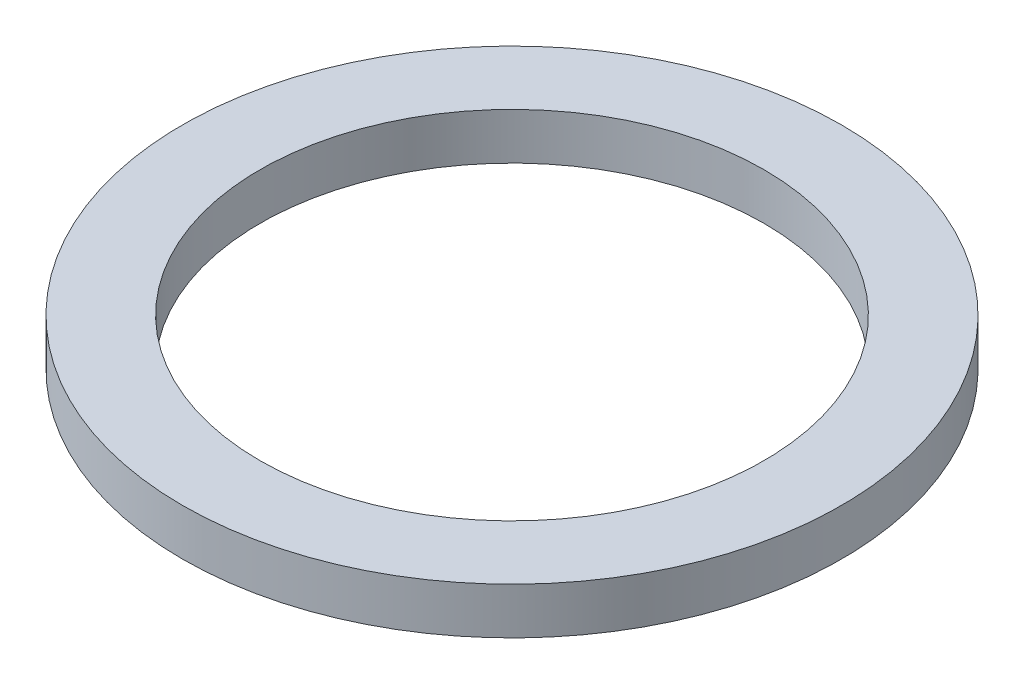
from build123d import *

# Parameters (mm, degrees)
ESQUISSE1_R        = 4.25
ESQUISSE1_R_2      = 3.25
BOSS_EXTRU_1_DEPTH = 0.6


with BuildPart() as part:
    # Esquisse1 → Boss.-Extru.1 (new body)
    with BuildSketch(Plane(origin=(0, 0, 0), x_dir=(1, 0, 0), z_dir=(0, 1, 0))):
        with Locations(Location((0, 0, 0), (0, 0, 270))):
            Circle(ESQUISSE1_R)
        with Locations(Location((0, 0, 0), (0, 0, 270))):
            Circle(ESQUISSE1_R_2, mode=Mode.SUBTRACT)
    extrude(amount=BOSS_EXTRU_1_DEPTH)


solid = part.part
